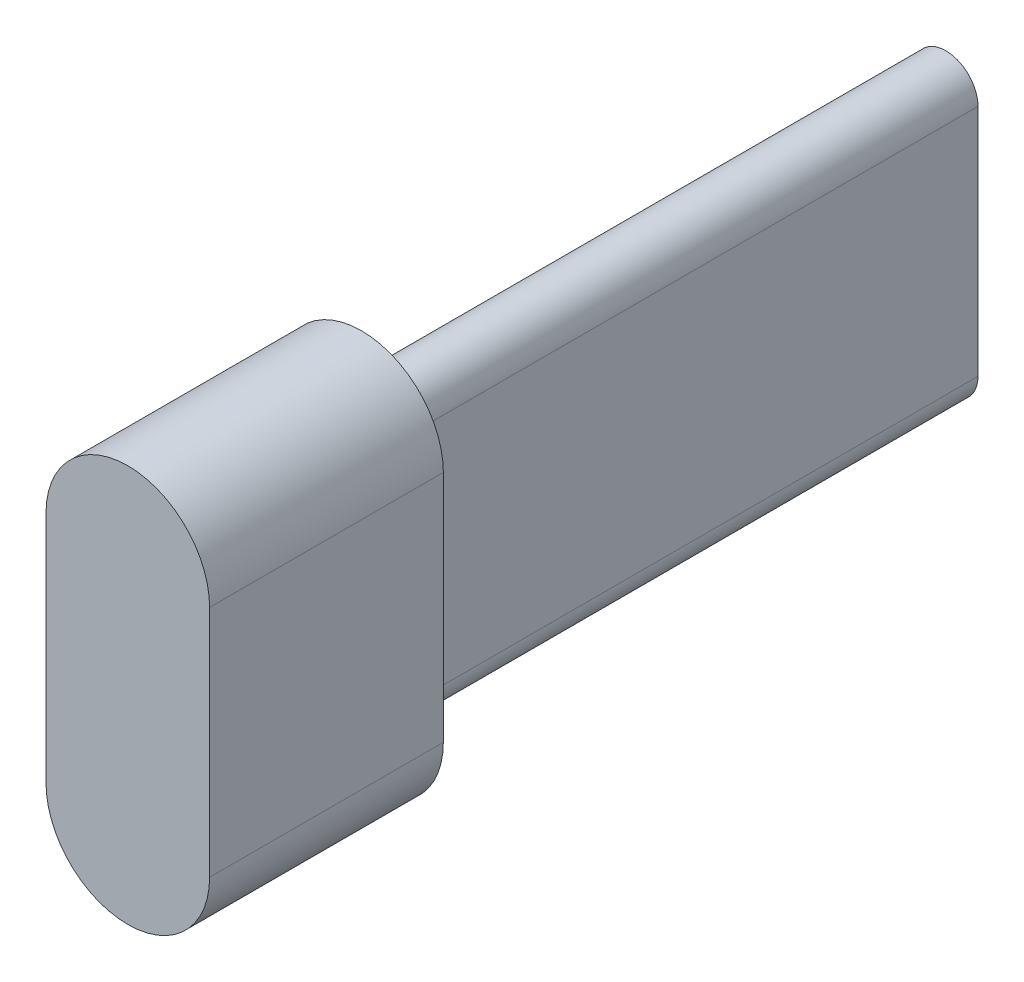
from build123d import *

# Parameters (mm, degrees)
EXTRUDE_1_DEPTH = 20
EXTRUDE_2_DEPTH = 8


with BuildPart() as part:
    # 草图1 → 凸台-拉伸1 (new body)
    with BuildSketch(Plane.XY):
        with BuildLine():
            Line((-6.453218026, -26.118509408), (-6.453218026, -34.118509408))
            ThreePointArc((-6.453218026, -34.118509408), (-5.353218026, -35.218509408), (-4.253218026, -34.118509408))
            Line((-4.253218026, -34.118509408), (-4.253218026, -26.118509408))
            ThreePointArc((-4.253218026, -26.118509408), (-5.353218026, -25.018509408), (-6.453218026, -26.118509408))
        make_face()
    extrude(amount=-EXTRUDE_1_DEPTH)

    # 草图2 → 凸台-拉伸2 (add)
    with BuildSketch(Plane.XY):
        with BuildLine():
            Line((-2.553218026, -34.118509408), (-2.553218026, -26.118509408))
            ThreePointArc((-2.553218026, -26.118509408), (-5.353218026, -23.318509408), (-8.153218026, -26.118509408))
            Line((-8.153218026, -26.118509408), (-8.153218026, -34.118509408))
            ThreePointArc((-8.153218026, -34.118509408), (-5.353218026, -36.918509408), (-2.553218026, -34.118509408))
        make_face()
    extrude(amount=EXTRUDE_2_DEPTH)


solid = part.part
